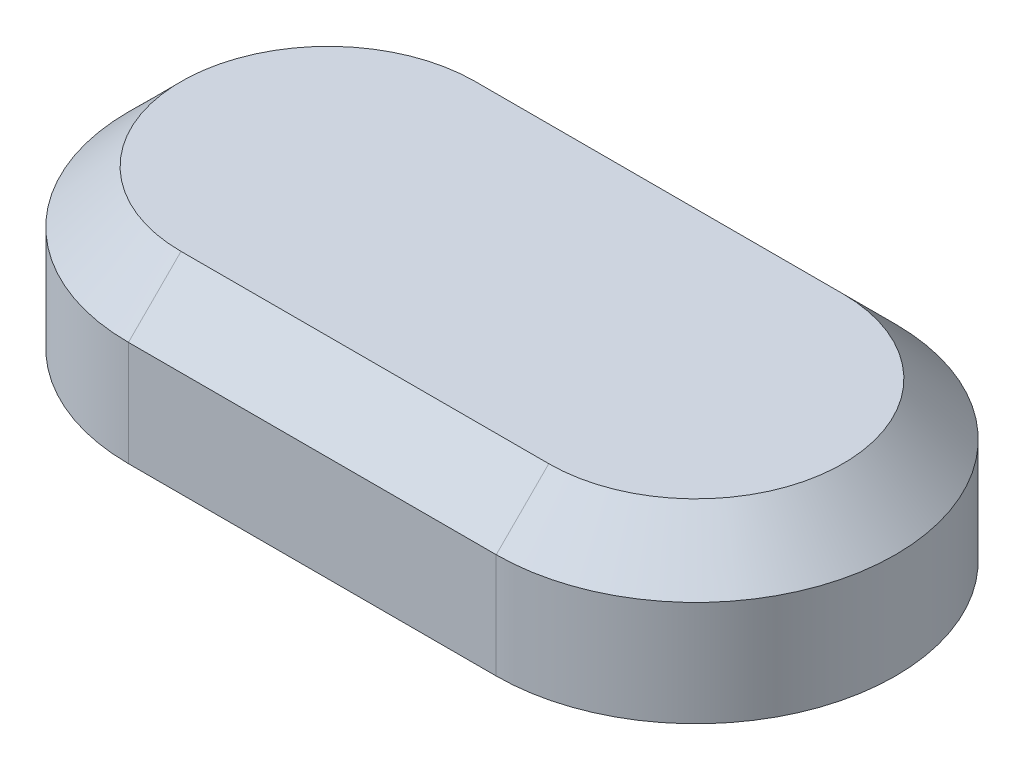
from build123d import *

# Parameters (mm, degrees)
BOSS_EXTRU_1_DEPTH = 3
CHANFREIN1_SIZE    = 1


with BuildPart() as part:
    # Esquisse1 → Boss.-Extru.1 (new body)
    with BuildSketch(Plane(origin=(0, 0, 0), x_dir=(1, 0, 0), z_dir=(0, 1, 0))):
        with BuildLine():
            Line((-3.5, 3.8), (3.5, 3.8))
            ThreePointArc((3.5, 3.8), (7.3, 0), (3.5, -3.8))
            Line((3.5, -3.8), (-3.5, -3.8))
            ThreePointArc((-3.5, -3.8), (-7.3, 0), (-3.5, 3.8))
        make_face()
    extrude(amount=BOSS_EXTRU_1_DEPTH)

    # Chanfrein1
    chanfrein1_edges = [part.edges().sort_by_distance(p)[0] for p in [
        (7.3, 3, 0),
        (0, 3, -3.8),
        (-7.3, 3, 0),
        (0, 3, 3.8),
    ]]
    chamfer(chanfrein1_edges, length=CHANFREIN1_SIZE)


solid = part.part
